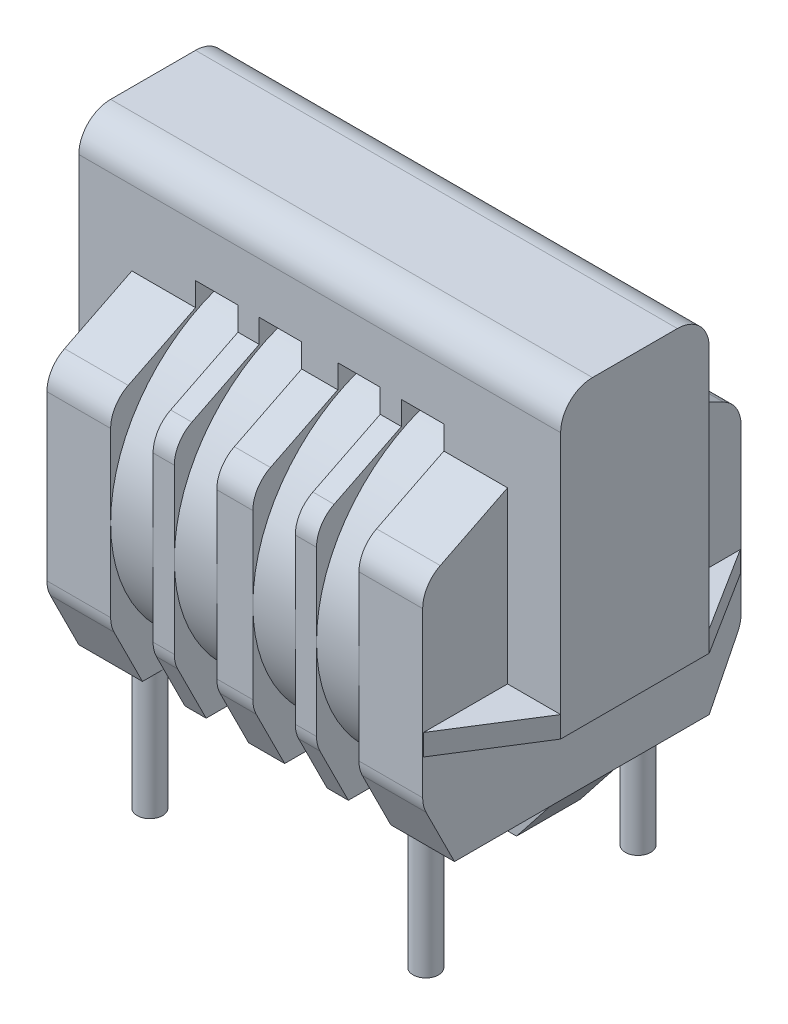
from build123d import *

# Parameters (mm, degrees)
EXTRUDE_1_DEPTH          = 17.7
FILLET_1_R               = 1.5
EXTRUDE_2_DEPTH          = 2.5
EXTRUDE_2_DEPTH_BACK     = 20.2
EXTRUDE_3_DEPTH          = 1
MIRROR_6_COPY_1_DEPTH    = 1
SKETCH_5_R               = 0.6
EXTRUDE_4_DEPTH          = 6
EXTRUDE_6_DEPTH          = 1.5
SKETCH_9_R               = 7.5
CUT_EXTRUDE_1_DEPTH      = 2
PATTERN_LINEAR_1_COUNT   = 2
PATTERN_LINEAR_1_PITCH   = 3
MIRROR_8_COPY_1_SKETCH_R = 7.5
MIRROR_8_COPY_1_DEPTH    = 2


with BuildPart() as part:
    # Эскиз1 → Бобышка-Вытянуть1 (new body)
    with BuildSketch(Plane(origin=(0, 0, 0), x_dir=(0, 0, -1), z_dir=(1, 0, 0))):
        Polygon((-7.5, 2.5), (-3.5, 4.5), (-3.5, 9.5), (3.5, 9.5), (3.5, 4.5), (7.5, 2.5), (7.5, -6.5), (6, -9.5), (-6, -9.5), (-7.5, -6.5), align=None)
    extrude(amount=EXTRUDE_1_DEPTH)

    # Скругление1
    fillet_1_edges = [part.edges().sort_by_distance(p)[0] for p in [
        (8.85, 2.5, -7.5),
        (8.85, -6.5, -7.5),
        (8.85, -6.5, 7.5),
        (8.85, 2.5, 7.5),
        (8.85, 9.5, 3.5),
        (8.85, 9.5, -3.5),
    ]]
    fillet(fillet_1_edges, radius=FILLET_1_R)

    # Эскиз2 → Бобышка-Вытянуть2 (add, two sides: drawn at the far end of the back side and taken through both)
    with BuildSketch(Plane.ZY.offset(-EXTRUDE_2_DEPTH_BACK)):
        with BuildLine():
            Line((-2, 9.5), (2, 9.5))
            ThreePointArc((2, 9.5), (3.06066, 9.06066), (3.5, 8))
            Line((3.5, 8), (3.5, -4.5))
            Line((3.5, -4.5), (-3.5, -4.5))
            Line((-3.5, -4.5), (-3.5, 8))
            ThreePointArc((-3.5, 8), (-3.06066, 9.06066), (-2, 9.5))
        make_face()
    extrude(amount=EXTRUDE_2_DEPTH + EXTRUDE_2_DEPTH_BACK)

    # Эскиз4 → Бобышка-Вытянуть3 (add)
    with BuildSketch(Plane.XZ.offset(4.5)):
        Polygon((0, 3.5), (-2.5, 3.5), (0, 7.464813), align=None)
    extrude_3 = extrude(amount=-EXTRUDE_3_DEPTH)

    # Зеркальное отражение4: Бобышка-Вытянуть3 across plane
    add(extrude_3.mirror(Plane.XY))

    # Зеркальное отражение6: Бобышка-Вытянуть3 across plane
    add(extrude_3.mirror(Plane.ZY.offset(-8.85)))

    # Зеркальное отражение6 copy 1 sketch → Зеркальное отражение6 copy 1 (add)
    with BuildSketch(Plane(origin=(17.7, -4.5, 0), x_dir=(-1, 0, 0), z_dir=(0, -1, 0))):
        Polygon((0, 3.5), (-2.5, 3.5), (0, 7.464813), align=None)
    extrude(amount=-MIRROR_6_COPY_1_DEPTH)

    # Эскиз5 → Бобышка-Вытянуть4 (add)
    with BuildSketch(Plane.XZ.offset(9.5)):
        with Locations(Location((2.35, 5, 0), (0, 0, 90))):
            Circle(SKETCH_5_R)
        with Locations(Location((15.35, 5, 0), (0, 0, 90))):
            Circle(SKETCH_5_R)
        with Locations(Location((15.35, -5, 0), (0, 0, 90))):
            Circle(SKETCH_5_R)
        with Locations(Location((2.35, -5, 0), (0, 0, 90))):
            Circle(SKETCH_5_R)
    extrude(amount=EXTRUDE_4_DEPTH)

    # Эскиз8 → Бобышка-Вытянуть6 (add, symmetric)
    with BuildSketch(Plane.XY):
        Polygon((2, -9.5), (0, -9.5), (1.577317, -11.5), (2, -11.5), align=None)
    extrude_6 = extrude(amount=EXTRUDE_6_DEPTH, both=True)

    # Зеркальное отражение7: Бобышка-Вытянуть6 across plane
    add(extrude_6.mirror(Plane.ZY.offset(-8.85)))

    # Эскиз9 → Вырез-Вытянуть1 (cut)
    with BuildSketch(Plane.ZY.offset(-3)):
        with BuildLine():
            Line((-4.744729, -9.5), (-6, -9.5))
            Line((-6, -9.5), (-7.307128, -6.885745))
            ThreePointArc((-7.307128, -6.885745), (0, 6.347609), (7.307128, -6.885745))
            Line((7.307128, -6.885745), (6, -9.5))
            Line((6, -9.5), (4.744729, -9.5))
            ThreePointArc((4.744729, -9.5), (0, -10.920558), (-4.744729, -9.5))
        make_face()
        with Locations((0, -2.286475)):
            Circle(SKETCH_9_R, mode=Mode.SUBTRACT)
    cut_extrude_1 = extrude(amount=-CUT_EXTRUDE_1_DEPTH, mode=Mode.SUBTRACT)

    # Линейный массив1: Вырез-Вытянуть1 ×2
    with Locations(*[(i * PATTERN_LINEAR_1_PITCH, 0, 0) for i in range(1, PATTERN_LINEAR_1_COUNT)]):
        add(cut_extrude_1, mode=Mode.SUBTRACT)

    # Зеркальное отражение8: Вырез-Вытянуть1 across plane
    add(cut_extrude_1.mirror(Plane.ZY.offset(-8.85)), mode=Mode.SUBTRACT)

    # Зеркальное отражение8 copy 1 sketch → Зеркальное отражение8 copy 1 (cut)
    with BuildSketch(Plane(origin=(11.7, 0, 0), x_dir=(0, 0, 1), z_dir=(1, 0, 0))):
        with BuildLine():
            Line((-4.744729, 9.5), (-6, 9.5))
            Line((-6, 9.5), (-7.307128, 6.885745))
            ThreePointArc((-7.307128, 6.885745), (0, -6.347609), (7.307128, 6.885745))
            Line((7.307128, 6.885745), (6, 9.5))
            Line((6, 9.5), (4.744729, 9.5))
            ThreePointArc((4.744729, 9.5), (0, 10.920558), (-4.744729, 9.5))
        make_face()
        with Locations((0, 2.286475)):
            Circle(MIRROR_8_COPY_1_SKETCH_R, mode=Mode.SUBTRACT)
    extrude(amount=-MIRROR_8_COPY_1_DEPTH, mode=Mode.SUBTRACT)


solid = part.part
